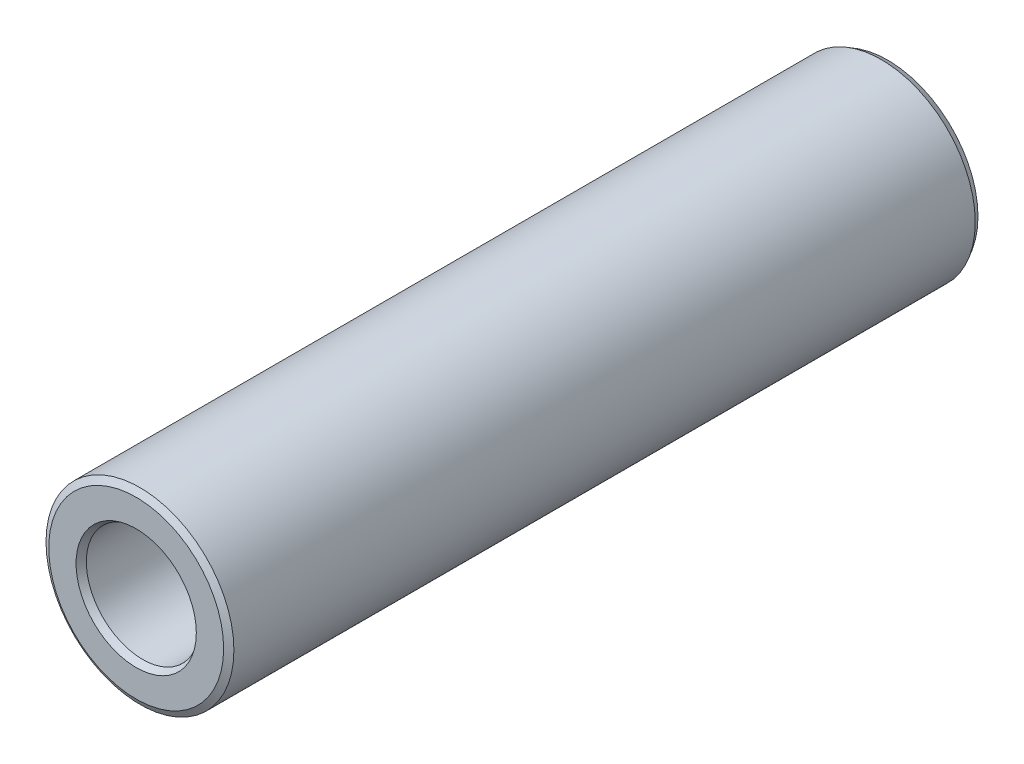
from build123d import *
from OCP.BRepFilletAPI import BRepFilletAPI_MakeChamfer

# Parameters (mm, degrees)
SKETCH1_R           = 2.5
SKETCH1_R_2         = 1.5
BOSS_EXTRUDE1_DEPTH = 10
CHAMFER1_SIZE       = 0.1
CHAMFER1_SIZE2      = 0.173205081


with BuildPart() as part:
    # Sketch1 → Boss-Extrude1 (new, symmetric)
    with BuildSketch(Plane.XY):
        Circle(SKETCH1_R)
        Circle(SKETCH1_R_2, mode=Mode.SUBTRACT)
    extrude(amount=BOSS_EXTRUDE1_DEPTH, both=True)

    # Chamfer1: one chamfer whose edges measure the first distance from different faces: ONE call of the kernel's chamfer builder (chamfer() names one face for all edges)
    chamfer1_edges_1 = [part.edges().sort_by_distance(p)[0] for p in [
        (-2.5, 0, -10),
    ]]
    chamfer1_side_1 = [part.faces().sort_by_distance(p)[0] for p in [
        (-2.429289322, 0, -10),
    ]]
    chamfer1_edges_2 = [part.edges().sort_by_distance(p)[0] for p in [
        (-2.5, 0, 10),
    ]]
    chamfer1_side_2 = [part.faces().sort_by_distance(p)[0] for p in [
        (-2.5, 0, 0),
    ]]
    chamfer1_edges_3 = [part.edges().sort_by_distance(p)[0] for p in [
        (-1.5, 0, -10),
    ]]
    chamfer1_side_3 = [part.faces().sort_by_distance(p)[0] for p in [
        (-1.5, 0, 0),
    ]]
    chamfer1_edges_4 = [part.edges().sort_by_distance(p)[0] for p in [
        (-1.5, 0, 10),
    ]]
    chamfer1_side_4 = [part.faces().sort_by_distance(p)[0] for p in [
        (-2.429289322, 0, 10),
    ]]
    chamfer1 = BRepFilletAPI_MakeChamfer(part.part.solid().wrapped)
    for e in chamfer1_edges_1:
        chamfer1.Add(CHAMFER1_SIZE, CHAMFER1_SIZE2, e.wrapped, chamfer1_side_1[0].wrapped)  # the first distance lies on this face
    for e in chamfer1_edges_2:
        chamfer1.Add(CHAMFER1_SIZE, CHAMFER1_SIZE2, e.wrapped, chamfer1_side_2[0].wrapped)  # the first distance lies on this face
    for e in chamfer1_edges_3:
        chamfer1.Add(CHAMFER1_SIZE, CHAMFER1_SIZE2, e.wrapped, chamfer1_side_3[0].wrapped)  # the first distance lies on this face
    for e in chamfer1_edges_4:
        chamfer1.Add(CHAMFER1_SIZE, CHAMFER1_SIZE2, e.wrapped, chamfer1_side_4[0].wrapped)  # the first distance lies on this face
    add(Compound.cast(chamfer1.Shape()), mode=Mode.REPLACE)


solid = part.part
